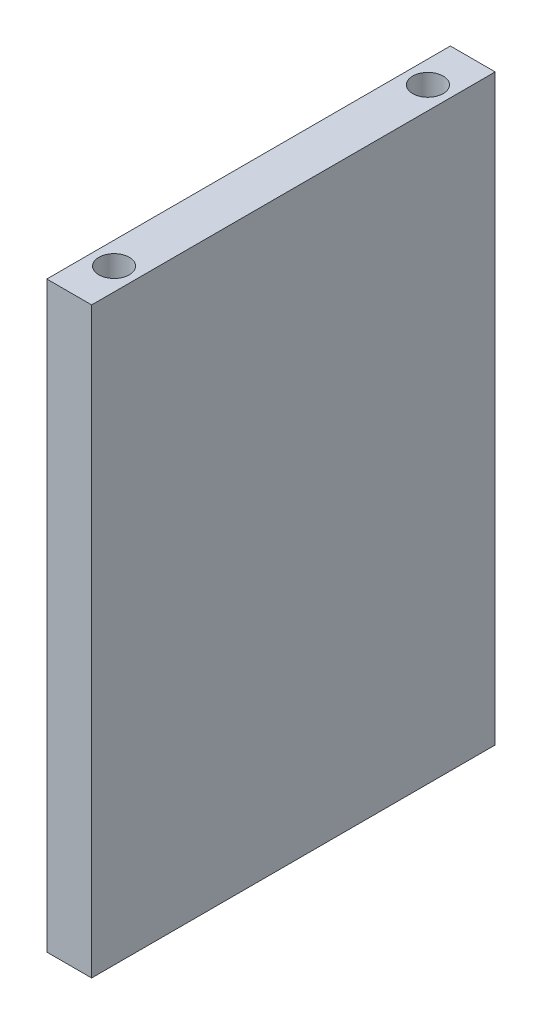
from build123d import *

# Parameters (mm, degrees)
SKETCH1_W                = 5
SKETCH1_H                = 45
BOSS_EXTRUDE1_DEPTH      = 65
M3_CLEARANCE_HOLE1_D     = 3.4
M3_CLEARANCE_HOLE1_DEPTH = 7
M3_CLEARANCE_HOLE1_TIP   = 1.021463052
M3_CLEARANCE_HOLE2_D     = 3.4
M3_CLEARANCE_HOLE2_DEPTH = 7
M3_CLEARANCE_HOLE2_TIP   = 1.021463052


with BuildPart() as part:
    # Sketch1 → Boss-Extrude1 (new body)
    with BuildSketch(Plane(origin=(0, 0, 0), x_dir=(1, 0, 0), z_dir=(0, 1, 0))):
        with Locations((2.5, 22.5)):
            Rectangle(SKETCH1_W, SKETCH1_H)
    extrude(amount=BOSS_EXTRUDE1_DEPTH)

    # M3 Clearance Hole1
    with Locations(Plane(origin=(0, 65, 0), x_dir=(1, 0, 0), z_dir=(0, 1, 0))):
        with Locations((2.5, 40), (2.5, 5)):
            Hole(M3_CLEARANCE_HOLE1_D / 2, depth=M3_CLEARANCE_HOLE1_DEPTH)
            with Locations((0, 0, -(M3_CLEARANCE_HOLE1_DEPTH + M3_CLEARANCE_HOLE1_TIP / 2))):  # 118° drill point
                Cone(0, M3_CLEARANCE_HOLE1_D / 2, M3_CLEARANCE_HOLE1_TIP, mode=Mode.SUBTRACT)

    # M3 Clearance Hole2
    with Locations(Plane(origin=(0, 0, 0), x_dir=(-1, 0, 0), z_dir=(0, -1, 0))):
        with Locations((-2.5, 39.999655037), (-2.5, 4.999655037)):
            Hole(M3_CLEARANCE_HOLE2_D / 2, depth=M3_CLEARANCE_HOLE2_DEPTH)
            with Locations((0, 0, -(M3_CLEARANCE_HOLE2_DEPTH + M3_CLEARANCE_HOLE2_TIP / 2))):  # 118° drill point
                Cone(0, M3_CLEARANCE_HOLE2_D / 2, M3_CLEARANCE_HOLE2_TIP, mode=Mode.SUBTRACT)


solid = part.part
